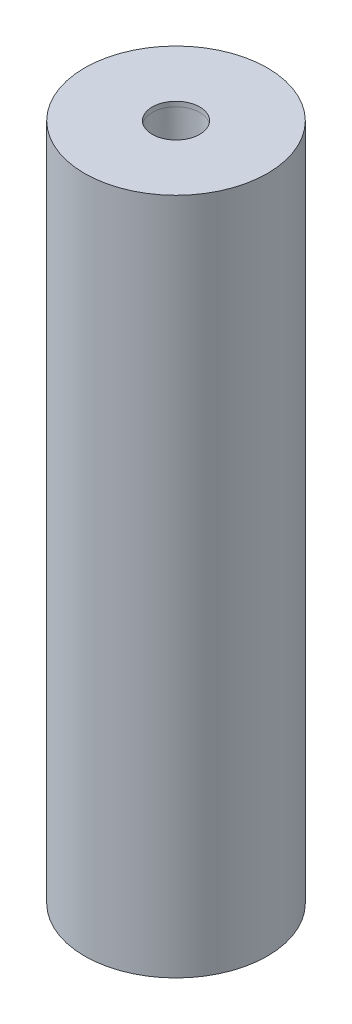
from build123d import *


with BuildPart() as part:
    # Sketch1 → Revolve2 (revolve)
    with BuildSketch(Plane.XY, mode=Mode.PRIVATE) as revolve2_sk:
        Polygon((-2.517455065, 1), (-4.94370909, 140), (-4.94370909, 141), (-19.021058506, 141), (-19.021058506, 140), (-19.021058506, 0), (-15.577349416, 0), (-18.021058506, 140), (-15.75187348, 140), (-13.30816439, 0), (-12.308012062, 0), (-14.751721152, 140), (-12.482536126, 140), (-10.038827036, 0), (-9.038674708, 0), (-11.482383798, 140), (-9.213198772, 140), (-6.769489682, 0), (-5.769337354, 0), (-8.213046444, 140), (-5.943861418, 140), (-3.500152328, 0), (-2.5, 0), (0, 0), (0, 1), align=None)
    revolve(revolve2_sk.sketch.rotate(Axis((0, 0, 0), (0, 1, 0)), 270), axis=Axis((0, 0, 0), (0, 1, 0)))


solid = part.part
